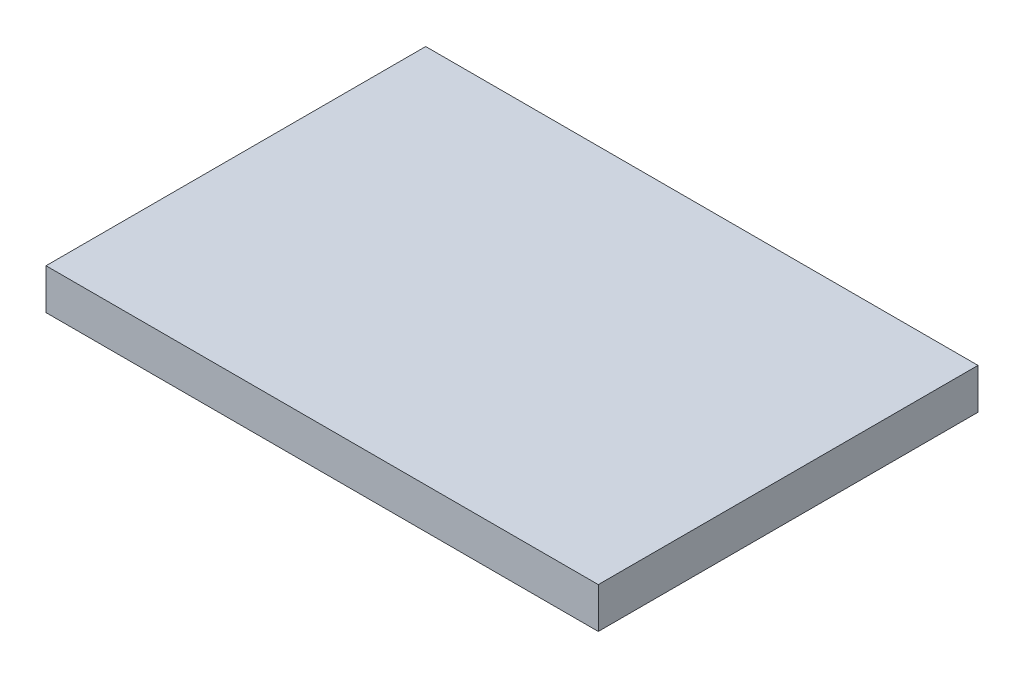
from build123d import *

# Parameters (mm, degrees)
SKETCH1_W           = 272
SKETCH1_H           = 187
BOSS_EXTRUDE1_DEPTH = 20


with BuildPart() as part:
    # Sketch1 → Boss-Extrude1 (new body)
    with BuildSketch(Plane(origin=(0, 0, 0), x_dir=(1, 0, 0), z_dir=(0, 1, 0))):
        Rectangle(SKETCH1_W, SKETCH1_H)
    extrude(amount=BOSS_EXTRUDE1_DEPTH)


solid = part.part
